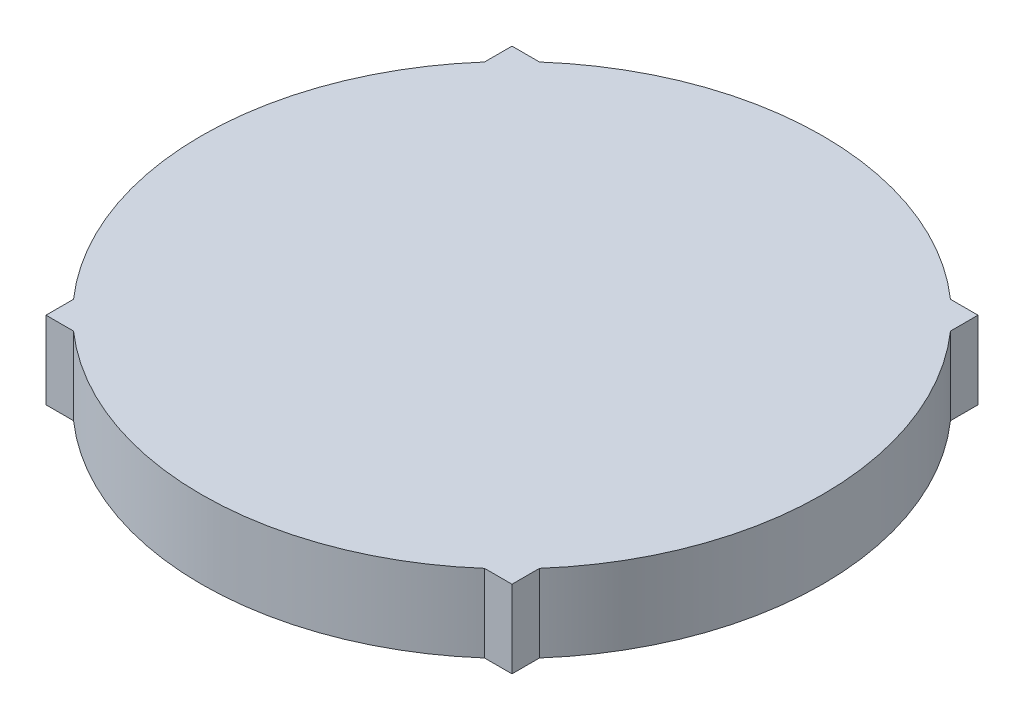
from build123d import *

# Parameters (mm, degrees)
BOSS_EXTRUDE1_DEPTH = 3.175
SKETCH2_R           = 6.2992
CUT_EXTRUDE1_DEPTH  = 2.54


with BuildPart() as part:
    # Sketch1 → Boss-Extrude1 (new body)
    with BuildSketch(Plane.XZ.offset(66.817157288)):
        with BuildLine():
            Line((26.467944946, -26.475), (26.467944946, -25.350260413))
            ThreePointArc((26.467944946, -25.350260413), (29.642944946, -16.95), (26.467944946, -8.549739587))
            Line((26.467944946, -8.549739587), (26.467944946, -7.425))
            Line((26.467944946, -7.425), (25.343205359, -7.425))
            ThreePointArc((25.343205359, -7.425), (16.942944946, -4.25), (8.542684533, -7.425))
            Line((8.542684533, -7.425), (7.417944946, -7.425))
            Line((7.417944946, -7.425), (7.417944946, -8.549739587))
            ThreePointArc((7.417944946, -8.549739587), (4.242944946, -16.95), (7.417944946, -25.350260413))
            Line((7.417944946, -25.350260413), (7.417944946, -26.475))
            Line((7.417944946, -26.475), (8.542684533, -26.475))
            ThreePointArc((8.542684533, -26.475), (16.942944946, -29.65), (25.343205359, -26.475))
            Line((25.343205359, -26.475), (26.467944946, -26.475))
        make_face()
    extrude(amount=-BOSS_EXTRUDE1_DEPTH)

    # Sketch2 → Cut-Extrude1 (cut)
    with BuildSketch(Plane.XZ.offset(66.817157288)):
        with Locations(Location((16.942944946, -16.95, 0), (0, 0, 270))):
            Circle(SKETCH2_R)
    extrude(amount=-CUT_EXTRUDE1_DEPTH, mode=Mode.SUBTRACT)


solid = part.part
